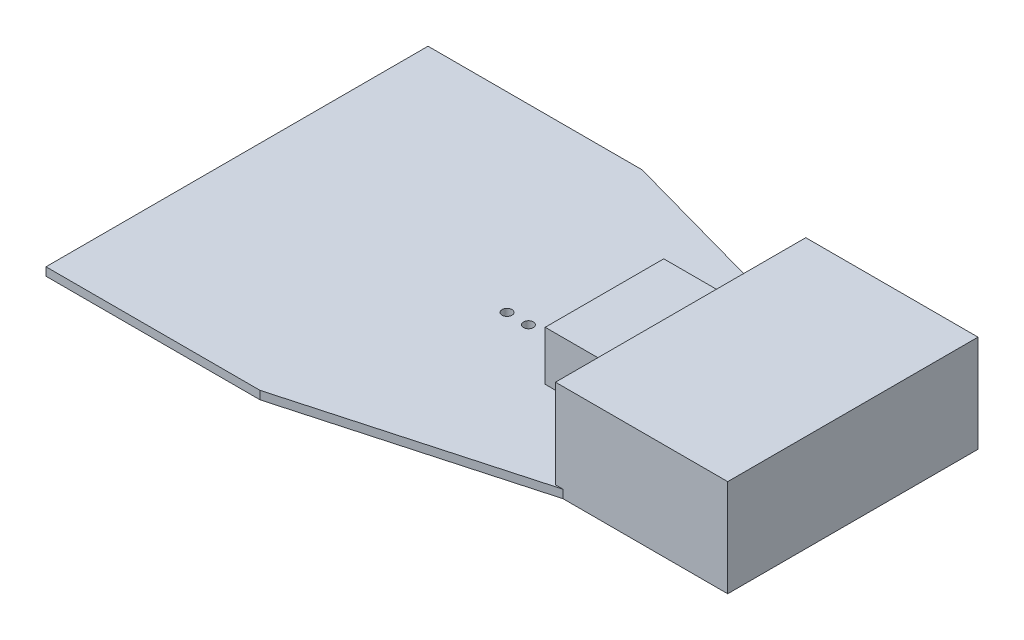
from build123d import *

# Parameters (mm, degrees)
BOSS_EXTRUDE1_DEPTH = 2.5
SKETCH2_R           = 1.5
CUT_EXTRUDE1_DEPTH  = 142.460566572
SKETCH3_R           = 1.5
CUT_EXTRUDE2_DEPTH  = 142.460566572
BOSS_EXTRUDE2_DEPTH = 15
SKETCH5_W           = 52.3
SKETCH5_H           = 76
BOSS_EXTRUDE3_DEPTH = 27


with BuildPart() as part:
    # Sketch1 → Boss-Extrude1 (new body)
    with BuildSketch(Plane(origin=(0, 0, 0), x_dir=(1, 0, 0), z_dir=(0, 1, 0))):
        Polygon((15.363173147, 23.82435142), (-56.636826853, 43.82435142), (-121.636826853, 43.82435142), (-121.636826853, -72.17564858), (-56.636826853, -72.17564858), (15.363173147, -52.17564858), (65.363173147, -52.17564858), (65.363173147, 23.82435142), align=None)
    extrude(amount=BOSS_EXTRUDE1_DEPTH)

    # Sketch2 → Cut-Extrude1 (cut, through all)
    with BuildSketch(Plane(origin=(0, 2.5, 0), x_dir=(1, 0, 0), z_dir=(0, 1, 0))):
        with Locations((-39.636826853, -14.17564858)):
            Circle(SKETCH2_R)
        with Locations((-33.136826853, -14.17564858)):
            Circle(SKETCH2_R)
    extrude(amount=-CUT_EXTRUDE1_DEPTH, mode=Mode.SUBTRACT)

    # Sketch3 → Cut-Extrude2 (cut, through all)
    with BuildSketch(Plane(origin=(0, 2.5, 0), x_dir=(1, 0, 0), z_dir=(0, 1, 0))):
        with Locations((-0.936826853, 11.352129198)):
            Circle(SKETCH3_R)
        with Locations((-0.936826853, -29.947870802)):
            Circle(SKETCH3_R)
    extrude(amount=-CUT_EXTRUDE2_DEPTH, mode=Mode.SUBTRACT)

    # Sketch4 → Boss-Extrude2 (add)
    with BuildSketch(Plane(origin=(0, 2.5, 0), x_dir=(1, 0, 0), z_dir=(0, 1, 0))):
        Polygon((-0.936826853, 8.702129198), (-14.936826853, 8.702129198), (-14.936826853, -27.297870802), (-0.936826853, -27.297870802), (13.063173147, -27.297870802), (13.063173147, 8.702129198), align=None)
    extrude(amount=BOSS_EXTRUDE2_DEPTH)

    # Sketch5 → Boss-Extrude3 (add)
    with BuildSketch(Plane(origin=(0, 2.5, 0), x_dir=(1, 0, 0), z_dir=(0, 1, 0))):
        with Locations((39.213173147, -14.17564858)):
            Rectangle(SKETCH5_W, SKETCH5_H)
    extrude(amount=BOSS_EXTRUDE3_DEPTH)


solid = part.part
